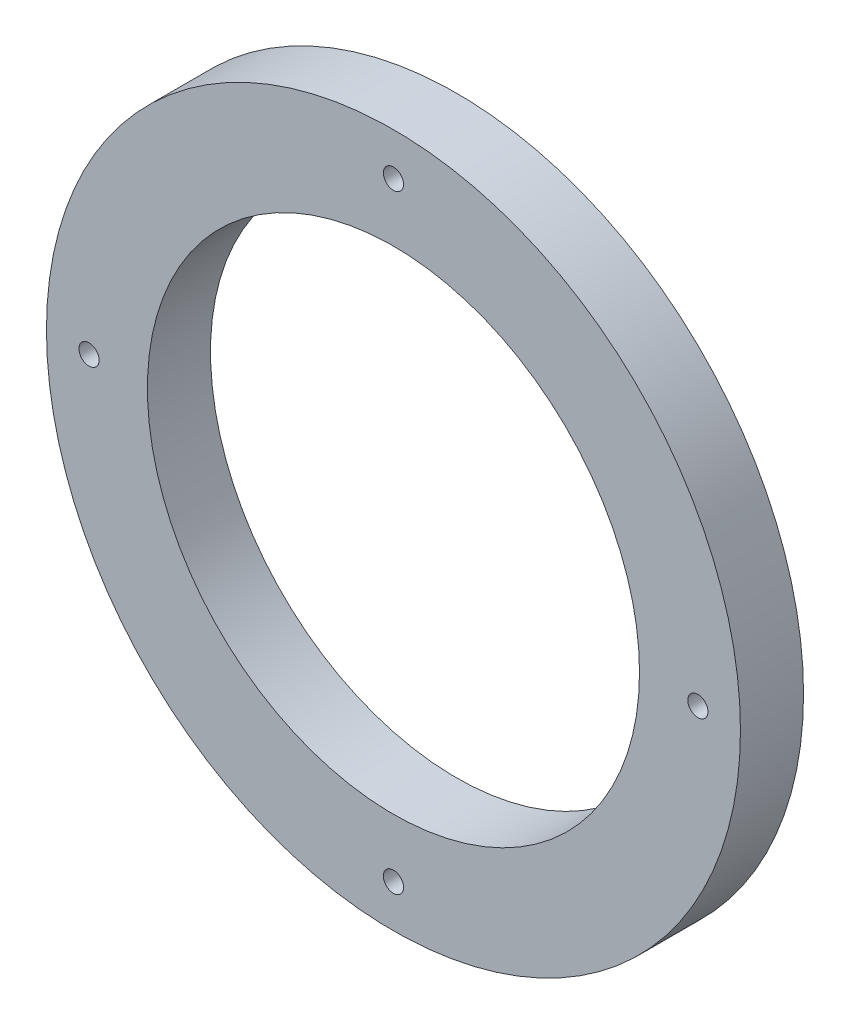
from build123d import *

# Parameters (mm, degrees)
SKETCH1_R           = 55
SKETCH1_R_2         = 39
SKETCH1_R_3         = 1.6
BOSS_EXTRUDE1_DEPTH = 10


with BuildPart() as part:
    # Sketch1 → Boss-Extrude1 (new body)
    with BuildSketch(Plane.XY):
        Circle(SKETCH1_R)
        Circle(SKETCH1_R_2, mode=Mode.SUBTRACT)
        with Locations((0, 48.25)):
            Circle(SKETCH1_R_3, mode=Mode.SUBTRACT)
        with Locations((48.25, 0)):
            Circle(SKETCH1_R_3, mode=Mode.SUBTRACT)
        with Locations((0, -48.25)):
            Circle(SKETCH1_R_3, mode=Mode.SUBTRACT)
        with Locations((-48.25, 0)):
            Circle(SKETCH1_R_3, mode=Mode.SUBTRACT)
    extrude(amount=BOSS_EXTRUDE1_DEPTH)


solid = part.part
